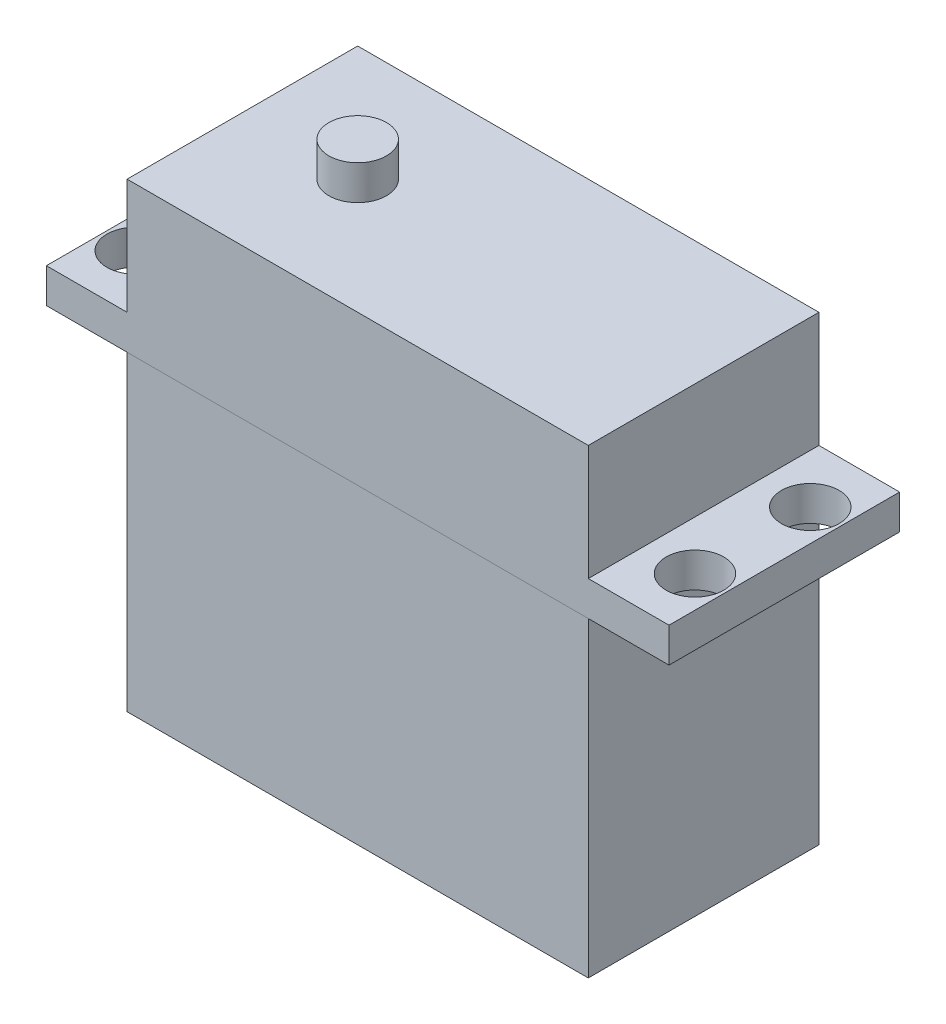
from build123d import *

# Parameters (mm, degrees)
SKETCH1_W           = 40
SKETCH1_H           = 20
BOSS_EXTRUDE1_DEPTH = 27
SKETCH2_W           = 54
SKETCH2_H           = 20
SKETCH2_R           = 2.5
BOSS_EXTRUDE4_DEPTH = 3
SKETCH3_W           = 40
SKETCH3_H           = 20
BOSS_EXTRUDE5_DEPTH = 10
SKETCH5_R           = 2.5
BOSS_EXTRUDE6_DEPTH = 3


with BuildPart() as part:
    # Sketch1 → Boss-Extrude1 (new body)
    with BuildSketch(Plane(origin=(0, 0, 0), x_dir=(1, 0, 0), z_dir=(0, 1, 0))):
        Rectangle(SKETCH1_W, SKETCH1_H)
    extrude(amount=BOSS_EXTRUDE1_DEPTH)


with BuildPart() as body_2:
    # Sketch2 → Boss-Extrude4 (new body)
    with BuildSketch(Plane(origin=(0, 27, 0), x_dir=(1, 0, 0), z_dir=(0, 1, 0))):
        Rectangle(SKETCH2_W, SKETCH2_H)
        with Locations(Location((-24.25, 5, 0), (0, 0, 270))):
            Circle(SKETCH2_R, mode=Mode.SUBTRACT)
        with Locations(Location((-24.25, -5, 0), (0, 0, 270))):
            Circle(SKETCH2_R, mode=Mode.SUBTRACT)
        with Locations(Location((24.25, -5, 0), (0, 0, 270))):
            Circle(SKETCH2_R, mode=Mode.SUBTRACT)
        with Locations(Location((24.25, 5, 0), (0, 0, 270))):
            Circle(SKETCH2_R, mode=Mode.SUBTRACT)
    extrude(amount=BOSS_EXTRUDE4_DEPTH)

    # Sketch3 → Boss-Extrude5 (add)
    with BuildSketch(Plane(origin=(0, 30, 0), x_dir=(1, 0, 0), z_dir=(0, 1, 0))):
        Rectangle(SKETCH3_W, SKETCH3_H)
    extrude(amount=BOSS_EXTRUDE5_DEPTH)

    # Sketch5 → Boss-Extrude6 (add)
    with BuildSketch(Plane(origin=(0, 40, 0), x_dir=(1, 0, 0), z_dir=(0, 1, 0))):
        with Locations(Location((-10, 0, 0), (0, 0, 90))):
            Circle(SKETCH5_R)
    extrude(amount=BOSS_EXTRUDE6_DEPTH)


solid = Compound([part.part, body_2.part])
